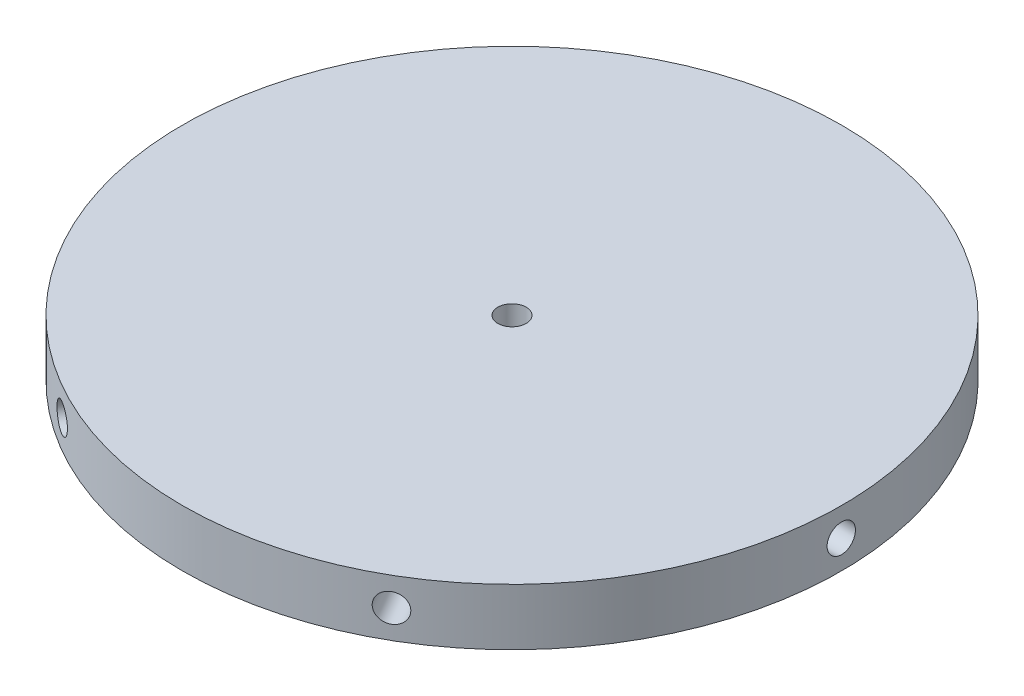
from build123d import *

# Parameters (mm, degrees)
SKETCH1_R           = 73.914
SKETCH1_R_2         = 3.175
BOSS_EXTRUDE1_DEPTH = 12.7
SKETCH2_R           = 3.175
CUT_EXTRUDE1_DEPTH  = 12.7
CIRPATTERN1_COUNT   = 6


with BuildPart() as part:
    # Sketch1 → Boss-Extrude1 (new body)
    with BuildSketch(Plane(origin=(0, 0, 0), x_dir=(1, 0, 0), z_dir=(0, 1, 0))):
        with Locations(Location((0, 0, 0), (0, 0, 270))):
            Circle(SKETCH1_R)
        with Locations(Location((0, 0, 0), (0, 0, 270))):
            Circle(SKETCH1_R_2, mode=Mode.SUBTRACT)
    extrude(amount=BOSS_EXTRUDE1_DEPTH)

    # Sketch2 → Cut-Extrude1 (cut)
    with BuildSketch(Plane(origin=(73.914, 0, 0), x_dir=(0, 0, -1), z_dir=(1, 0, 0))):
        with Locations((0, 6.35)):
            Circle(SKETCH2_R)
    cut_extrude1 = extrude(amount=-CUT_EXTRUDE1_DEPTH, mode=Mode.SUBTRACT)

    # CirPattern1: Cut-Extrude1 ×6 about axis
    cirpattern1_axis = Axis((0, 0, 0), (0, 1, 0))
    for i in range(1, CIRPATTERN1_COUNT):
        add(cut_extrude1.rotate(cirpattern1_axis, i * 360 / CIRPATTERN1_COUNT), mode=Mode.SUBTRACT)


solid = part.part
